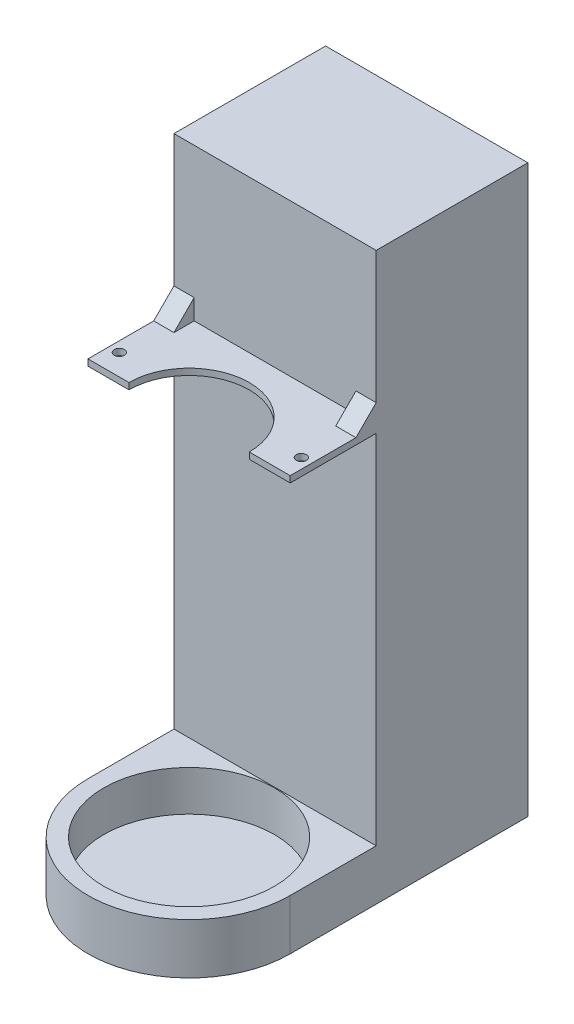
from build123d import *

# Parameters (mm, degrees)
SKETCH1_W            = 50.8
SKETCH1_H            = 142.24
BOSS_EXTRUDE1_DEPTH  = 38.1
SKETCH8_R            = 21.43125
BOSS_EXTRUDE2_DEPTH  = 2.54
SKETCH8_5_R          = 21.43125
BOSS_EXTRUDE9_DEPTH  = 12.7
BOSS_EXTRUDE13_DEPTH = 0.798558565
SKETCH16_R           = 1.27
CUT_EXTRUDE7_DEPTH   = 1.59711713
BOSS_EXTRUDE14_DEPTH = 5.08


with BuildPart() as part:
    # Sketch1 → Boss-Extrude1 (new body)
    with BuildSketch(Plane.XY):
        Rectangle(SKETCH1_W, SKETCH1_H)
    extrude(amount=BOSS_EXTRUDE1_DEPTH)



with BuildPart() as body_2:
    # Sketch8 → Boss-Extrude2 (new body)
    # profile 1 of 2: a face of its own
    with BuildSketch(Plane.XZ.offset(71.12)):
        with BuildLine():
            Line((-25.4, 38.1), (25.4, 38.1))
            Line((25.4, 38.1), (25.4, 59.69))
            ThreePointArc((25.4, 59.69), (0, 85.09), (-25.4, 59.69))
            Line((-25.4, 59.69), (-25.4, 38.1))
        make_face()
        with Locations((0, 59.69)):
            Circle(SKETCH8_R, mode=Mode.SUBTRACT)
    # profile 2 of 2: a face of its own
    with BuildSketch(Plane.XZ.offset(71.12)):
        with Locations((0, 59.69)):
            Circle(SKETCH8_R)
    extrude(amount=-BOSS_EXTRUDE2_DEPTH)


with BuildPart() as part_1:
    add(part.part)

    add(body_2.part)  # Boss-Extrude9 merges body 2
    # Sketch8<5> → Boss-Extrude9 (add)
    with BuildSketch(Plane.XZ.offset(71.12)):
        with BuildLine():
            Line((25.4, 38.1), (25.4, 59.69))
            ThreePointArc((25.4, 59.69), (0, 85.09), (-25.4, 59.69))
            Line((-25.4, 59.69), (-25.4, 38.1))
            Line((-25.4, 38.1), (25.4, 38.1))
        make_face()
        with Locations(Location((0, 59.69, 0), (0, 0, 270))):
            Circle(SKETCH8_5_R, mode=Mode.SUBTRACT)
    extrude(amount=-BOSS_EXTRUDE9_DEPTH)

    # Sketch15 → Boss-Extrude13 (add, symmetric)
    with BuildSketch(Plane(origin=(0, 32.108355434, 0), x_dir=(1, 0, 0), z_dir=(0, 1, 0))):
        with BuildLine():
            Line((-15.113, -59.69), (-25.4, -59.69))
            Line((-25.4, -59.69), (-25.4, -38.1))
            Line((-25.4, -38.1), (25.4, -38.1))
            Line((25.4, -38.1), (25.4, -59.69))
            Line((25.4, -59.69), (15.113, -59.69))
            ThreePointArc((15.113, -59.69), (0, -44.577), (-15.113, -59.69))
        make_face()
    extrude(amount=BOSS_EXTRUDE13_DEPTH, both=True)

    # Sketch16 → Cut-Extrude7 (cut)
    with BuildSketch(Plane(origin=(0, 32.906913999, 0), x_dir=(1, 0, 0), z_dir=(0, 1, 0))):
        with Locations(Location((-22.86, -54.356, 0), (0, 0, 270))):
            Circle(SKETCH16_R)
    cut_extrude7 = extrude(amount=-CUT_EXTRUDE7_DEPTH, mode=Mode.SUBTRACT)

    # Mirror1: Cut-Extrude7 across plane
    add(cut_extrude7.mirror(Plane(origin=(0, 0, 0), x_dir=(0, 0, 1), z_dir=(1, 0, 0))), mode=Mode.SUBTRACT)

    # Sketch17 → Boss-Extrude14 (add)
    with BuildSketch(Plane(origin=(25.4, 0, 0), x_dir=(0, 0, -1), z_dir=(1, 0, 0))):
        Polygon((-38.1, 32.906913999), (-38.1, 37.986913999), (-43.18, 32.906913999), align=None)
    boss_extrude14 = extrude(amount=-BOSS_EXTRUDE14_DEPTH)

    # Mirror2: Boss-Extrude14 across plane
    add(boss_extrude14.mirror(Plane(origin=(0, 0, 0), x_dir=(0, 0, 1), z_dir=(1, 0, 0))))


solid = part_1.part
